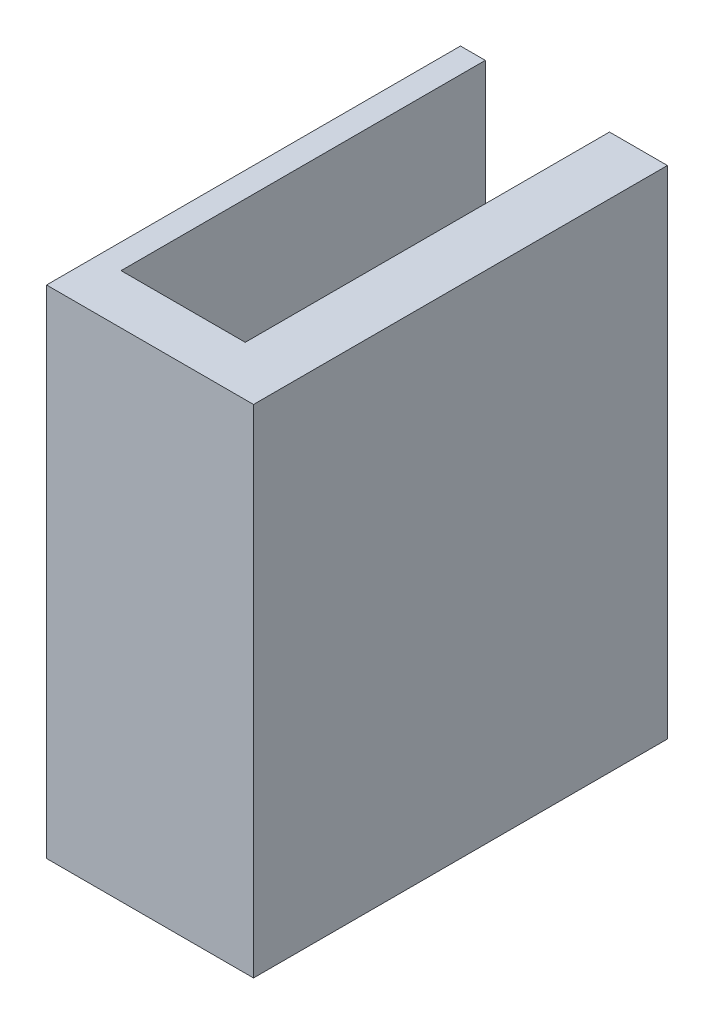
from build123d import *

# Parameters (mm, degrees)
EXTRUDE_1_DEPTH = 60


with BuildPart() as part:
    # 草图1 → 凸台-拉伸1 (new body)
    with BuildSketch(Plane(origin=(0, 0, 0), x_dir=(1, 0, 0), z_dir=(0, 1, 0))):
        Polygon((-9.5, 25), (-9.5, -19), (5.5, -19), (5.5, 25), (12.5, 25), (12.5, -25), (-12.5, -25), (-12.5, 25), align=None)
    extrude(amount=EXTRUDE_1_DEPTH)


solid = part.part
